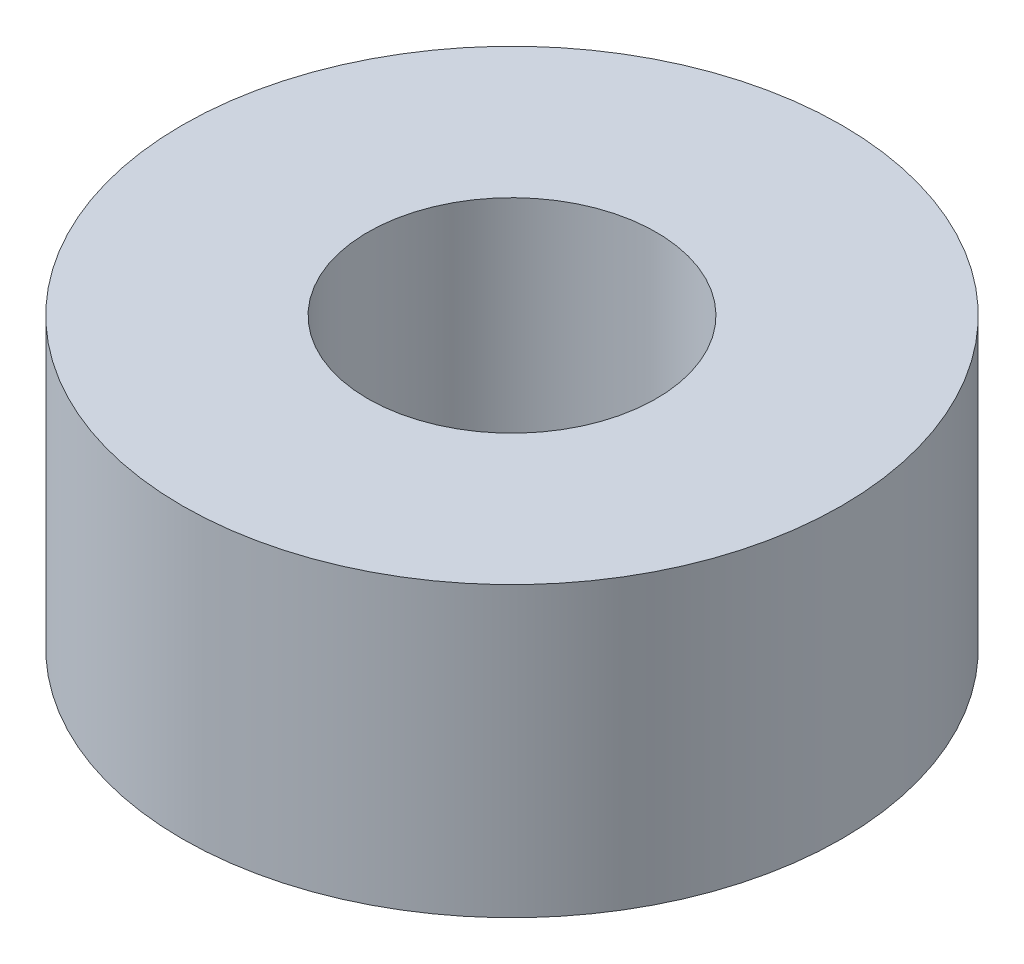
from build123d import *

# Parameters (mm, degrees)
SKETCH1_R           = 4
SKETCH1_R_2         = 1.75
BOSS_EXTRUDE1_DEPTH = 3.5


with BuildPart() as part:
    # Sketch1 → Boss-Extrude1 (new body)
    with BuildSketch(Plane(origin=(0, 0, 0), x_dir=(1, 0, 0), z_dir=(0, 1, 0))):
        with Locations(Location((0, 0, 0), (0, 0, 270))):
            Circle(SKETCH1_R)
        with Locations(Location((0, 0, 0), (0, 0, 270))):
            Circle(SKETCH1_R_2, mode=Mode.SUBTRACT)
    extrude(amount=BOSS_EXTRUDE1_DEPTH)


solid = part.part
